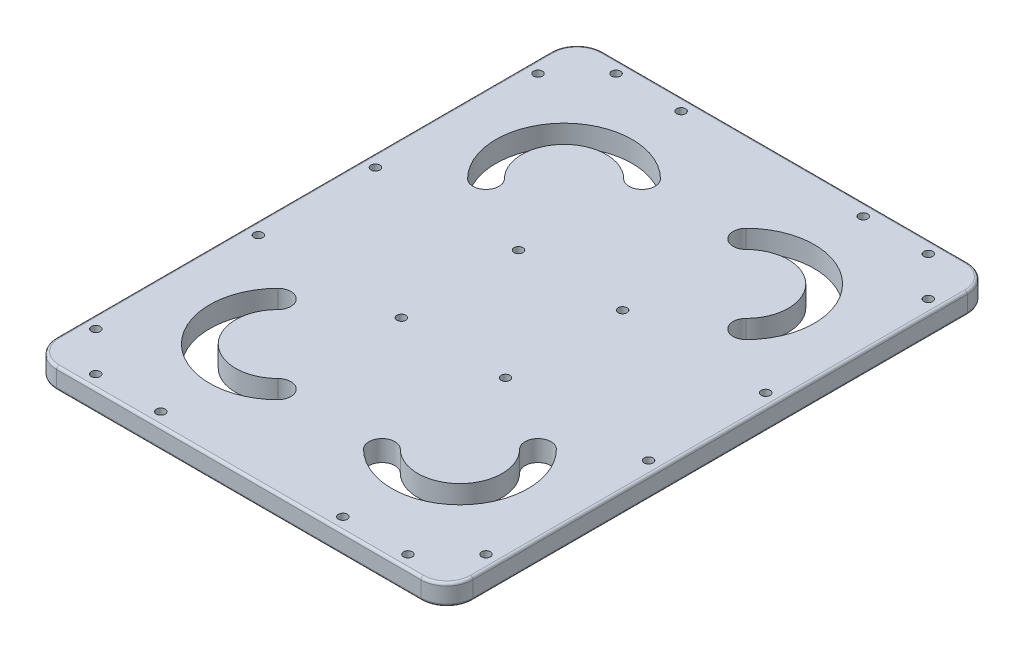
from build123d import *

# Parameters (mm, degrees)
SKETCH1_W           = 160
SKETCH1_H           = 210
BOSS_EXTRUDE1_DEPTH = 8
SKETCH2_R           = 1.7
CUT_EXTRUDE1_DEPTH  = 37
FILLET1_R           = 10
SKETCH3_R           = 1.7
CUT_EXTRUDE2_DEPTH  = 480
SKETCH4_R           = 1.7
CUT_EXTRUDE3_DEPTH  = 480
SKETCH5_R           = 1.7
CUT_EXTRUDE4_DEPTH  = 480
FILLET2_R           = 1
CUT_EXTRUDE5_DEPTH  = 63


with BuildPart() as part:
    # Sketch1 → Boss-Extrude1 (new body)
    with BuildSketch(Plane(origin=(0, 0, 0), x_dir=(1, 0, 0), z_dir=(0, 1, 0))):
        Rectangle(SKETCH1_W, SKETCH1_H)
    extrude(amount=BOSS_EXTRUDE1_DEPTH)

    # Sketch2 → Cut-Extrude1 (cut)
    with BuildSketch(Plane(origin=(0, 8, 0), x_dir=(1, 0, 0), z_dir=(0, 1, 0))):
        with Locations(Location((-75, 22.5, 0), (0, 0, 270))):
            Circle(SKETCH2_R)
        with Locations(Location((-75, -22.5, 0), (0, 0, 270))):
            Circle(SKETCH2_R)
        with Locations(Location((75, 22.5, 0), (0, 0, 270))):
            Circle(SKETCH2_R)
        with Locations(Location((75, -22.5, 0), (0, 0, 270))):
            Circle(SKETCH2_R)
    extrude(amount=-CUT_EXTRUDE1_DEPTH, mode=Mode.SUBTRACT)

    # Fillet1
    fillet1_edges = [part.edges().sort_by_distance(p)[0] for p in [
        (80, 4, 105),
        (-80, 4, 105),
        (-80, 4, -105),
        (80, 4, -105),
    ]]
    fillet(fillet1_edges, radius=FILLET1_R)

    # Sketch3 → Cut-Extrude2 (cut)
    with BuildSketch(Plane(origin=(0, 8, 0), x_dir=(1, 0, 0), z_dir=(0, 1, 0))):
        with Locations(Location((-20, 22.5, 0), (0, 0, 270))):
            Circle(SKETCH3_R)
        with Locations(Location((-20, -22.5, 0), (0, 0, 270))):
            Circle(SKETCH3_R)
        with Locations(Location((20, -22.5, 0), (0, 0, 270))):
            Circle(SKETCH3_R)
        with Locations(Location((20, 22.5, 0), (0, 0, 270))):
            Circle(SKETCH3_R)
    extrude(amount=-CUT_EXTRUDE2_DEPTH, mode=Mode.SUBTRACT)

    # Sketch4 → Cut-Extrude3 (cut)
    with BuildSketch(Plane(origin=(0, 8, 0), x_dir=(1, 0, 0), z_dir=(0, 1, 0))):
        with Locations(Location((-75.005871396, 85, 0), (0, 0, 270))):
            Circle(SKETCH4_R)
        with Locations(Location((-60.011742792, 100, 0), (0, 0, 270))):
            Circle(SKETCH4_R)
        with Locations(Location((-75.005871396, -85, 0), (0, 0, 270))):
            Circle(SKETCH4_R)
        with Locations(Location((-60.011742792, -100, 0), (0, 0, 270))):
            Circle(SKETCH4_R)
        with Locations(Location((60.011742792, -100, 0), (0, 0, 270))):
            Circle(SKETCH4_R)
        with Locations(Location((75.005871396, -85, 0), (0, 0, 270))):
            Circle(SKETCH4_R)
        with Locations(Location((75.005871396, 85, 0), (0, 0, 270))):
            Circle(SKETCH4_R)
        with Locations(Location((60.011742792, 100, 0), (0, 0, 270))):
            Circle(SKETCH4_R)
    extrude(amount=-CUT_EXTRUDE3_DEPTH, mode=Mode.SUBTRACT)

    # Sketch5 → Cut-Extrude4 (cut)
    with BuildSketch(Plane(origin=(0, 8, 0), x_dir=(1, 0, 0), z_dir=(0, 1, 0))):
        with Locations(Location((35, -100, 0), (0, 0, 270))):
            Circle(SKETCH5_R)
        with Locations(Location((-35, -100, 0), (0, 0, 270))):
            Circle(SKETCH5_R)
        with Locations(Location((35, 100, 0), (0, 0, 270))):
            Circle(SKETCH5_R)
        with Locations(Location((-35, 100, 0), (0, 0, 270))):
            Circle(SKETCH5_R)
    extrude(amount=-CUT_EXTRUDE4_DEPTH, mode=Mode.SUBTRACT)

    # Fillet2
    fillet2_edges = [part.edges().sort_by_distance(p)[0] for p in [
        (0, 0, 105),
        (0, 8, 105),
        (80, 0, 0),
        (-80, 0, 0),
        (0, 0, -105),
        (-77.071067812, 0, -102.071067812),
        (77.071067812, 0, -102.071067812),
        (77.071067812, 0, 102.071067812),
        (-77.071067812, 0, 102.071067812),
        (-80, 8, 0),
        (80, 8, 0),
        (0, 8, -105),
        (-77.071067812, 8, -102.071067812),
        (77.071067812, 8, -102.071067812),
        (77.071067812, 8, 102.071067812),
        (-77.071067812, 8, 102.071067812),
    ]]
    fillet(fillet2_edges, radius=FILLET2_R)

    # Sketch6 → Cut-Extrude5 (cut)
    with BuildSketch(Plane(origin=(0, 8, 0), x_dir=(1, 0, 0), z_dir=(0, 1, 0))):
        with BuildLine():
            ThreePointArc((53.535533906, 36.464466094), (53.535533906, 73.535533906), (16.464466094, 73.535533906))
            ThreePointArc((16.464466094, 73.535533906), (16.464466094, 66.464466094), (23.535533906, 66.464466094))
            ThreePointArc((23.535533906, 66.464466094), (46.464466094, 66.464466094), (46.464466094, 43.535533906))
            ThreePointArc((46.464466094, 43.535533906), (46.464466094, 36.464466094), (53.535533906, 36.464466094))
        make_face()
        with BuildLine():
            ThreePointArc((-53.535533906, 36.464466094), (-53.535533906, 73.535533906), (-16.464466094, 73.535533906))
            ThreePointArc((-16.464466094, 73.535533906), (-16.464466094, 66.464466094), (-23.535533906, 66.464466094))
            ThreePointArc((-23.535533906, 66.464466094), (-46.464466094, 66.464466094), (-46.464466094, 43.535533906))
            ThreePointArc((-46.464466094, 43.535533906), (-46.464466094, 36.464466094), (-53.535533906, 36.464466094))
        make_face()
        with BuildLine():
            ThreePointArc((53.535533906, -36.464466094), (53.535533906, -73.535533906), (16.464466094, -73.535533906))
            ThreePointArc((16.464466094, -73.535533906), (16.464466094, -66.464466094), (23.535533906, -66.464466094))
            ThreePointArc((23.535533906, -66.464466094), (46.464466094, -66.464466094), (46.464466094, -43.535533906))
            ThreePointArc((46.464466094, -43.535533906), (46.464466094, -36.464466094), (53.535533906, -36.464466094))
        make_face()
        with BuildLine():
            ThreePointArc((-53.535533906, -36.464466094), (-53.535533906, -73.535533906), (-16.464466094, -73.535533906))
            ThreePointArc((-16.464466094, -73.535533906), (-16.464466094, -66.464466094), (-23.535533906, -66.464466094))
            ThreePointArc((-23.535533906, -66.464466094), (-46.464466094, -66.464466094), (-46.464466094, -43.535533906))
            ThreePointArc((-46.464466094, -43.535533906), (-46.464466094, -36.464466094), (-53.535533906, -36.464466094))
        make_face()
    extrude(amount=-CUT_EXTRUDE5_DEPTH, mode=Mode.SUBTRACT)


solid = part.part
